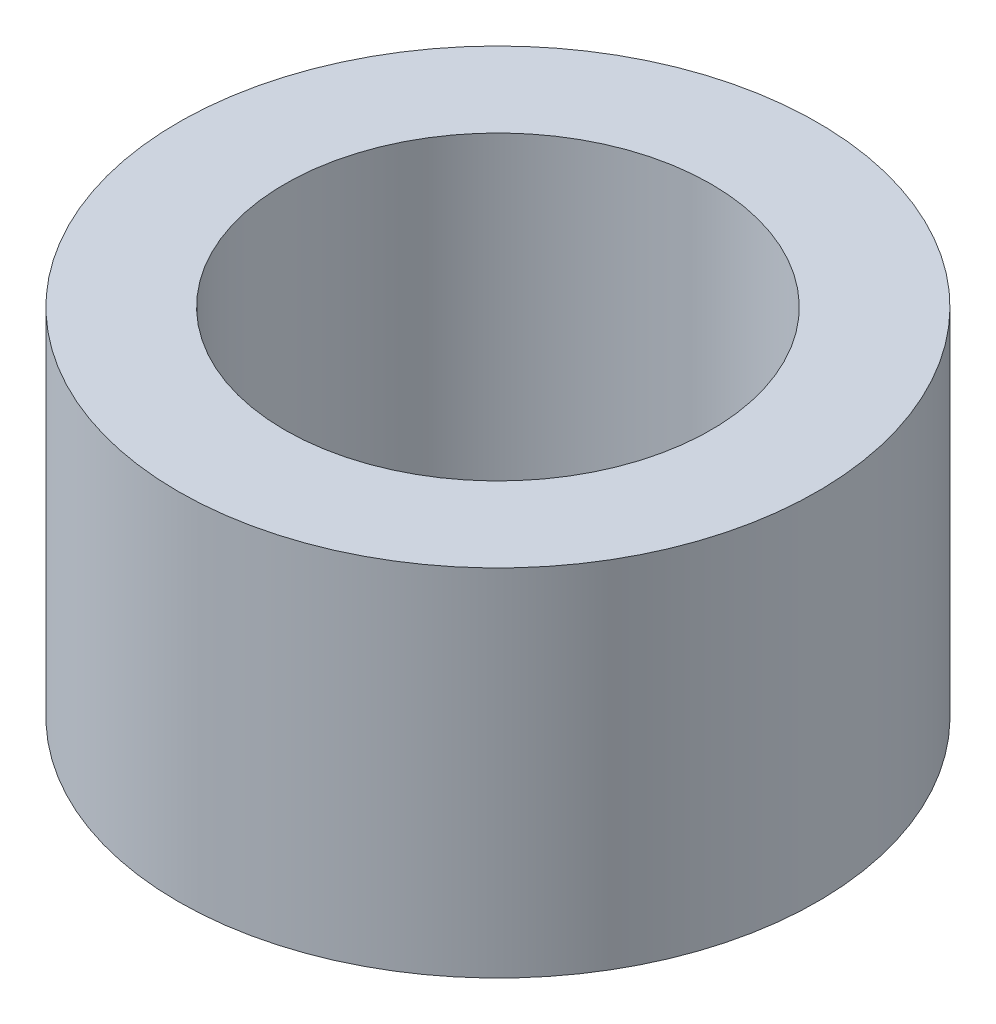
from build123d import *

# Parameters (mm, degrees)
SKETCH1_R           = 9
SKETCH1_R_2         = 6
BOSS_EXTRUDE1_DEPTH = 10


with BuildPart() as part:
    # Sketch1 → Boss-Extrude1 (new body)
    with BuildSketch(Plane(origin=(0, 0, 0), x_dir=(1, 0, 0), z_dir=(0, 1, 0))):
        with Locations(Location((0, 0, 0), (0, 0, 270))):
            Circle(SKETCH1_R)
        with Locations(Location((0, 0, 0), (0, 0, 270))):
            Circle(SKETCH1_R_2, mode=Mode.SUBTRACT)
    extrude(amount=BOSS_EXTRUDE1_DEPTH)


solid = part.part
